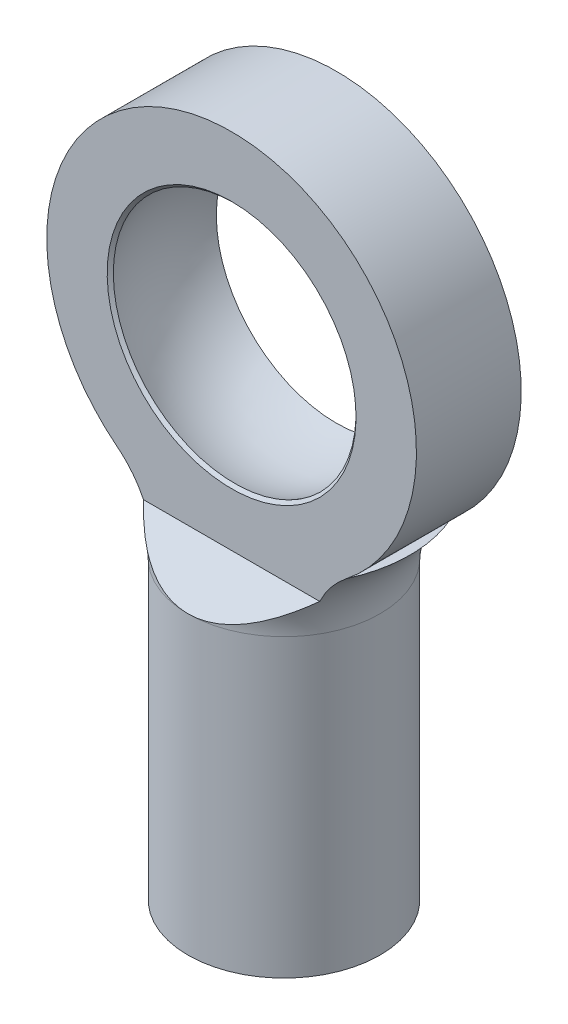
from build123d import *

# Parameters (mm, degrees)
CUT_EXTRUDE1_DEPTH      = 22.459263734
CUT_EXTRUDE1_DEPTH_BACK = 22.459263734
CUT_EXTRUDE2_DEPTH      = 21.923969522
CUT_EXTRUDE2_DEPTH_BACK = 21.923969522
SKETCH3_R               = 3
CHAMFER1_SIZE           = 0.125
CHAMFER1_SIZE2          = 0.094947636
CUT_EXTRUDE3_DEPTH      = 22.17339134
CUT_EXTRUDE3_DEPTH_BACK = 22.17339134
SKETCH7_R               = 1.5
CUT_EXTRUDE4_DEPTH      = 5


with BuildPart() as part:
    # Sketch1 → Revolve1 (revolve)
    with BuildSketch(Plane.XY, mode=Mode.PRIVATE) as revolve1_sk:
        with BuildLine():
            Line((0, 11), (0, 0))
            Line((0, 0), (2.75, 0))
            Line((2.75, 0), (2.75, 8.463651766))
            ThreePointArc((2.75, 8.463651766), (2.97496566, 9.500097013), (3.609375, 10.350010589))
            ThreePointArc((3.609375, 10.350010589), (5.151453278, 16.426792444), (0, 20))
            Line((0, 20), (0, 11))
        make_face()
    revolve(revolve1_sk.sketch.rotate(Axis((0, 0, 0), (0, -1, 0)), 90), axis=Axis((0, 0, 0), (0, -1, 0)))

    # Sketch2 → Cut-Extrude1 (cut, two sides: drawn at the far end of the back side and taken through both)
    with BuildSketch(Plane(origin=(0, 0, 0), x_dir=(0, 0, -1), z_dir=(1, 0, 0)).offset(-CUT_EXTRUDE1_DEPTH_BACK)):
        Polygon((-6.5, 9.406831178), (-2.75, 8.463651766), (-1.5, 9.406831178), (-1.5, 20.406831178), (-6.5, 20.406831178), align=None)
        Polygon((6.5, 20.406831178), (6.5, 9.406831178), (2.75, 8.463651766), (1.5, 9.406831178), (1.5, 20.406831178), align=None)
    extrude(amount=CUT_EXTRUDE1_DEPTH + CUT_EXTRUDE1_DEPTH_BACK, mode=Mode.SUBTRACT)

    # Sketch3 → Cut-Extrude2 (cut, two sides: drawn at the far end of the back side and taken through both)
    with BuildSketch(Plane.XY.offset(-CUT_EXTRUDE2_DEPTH_BACK)):
        with Locations(Location((0, 14.5, 0), (0, 0, 90))):
            Circle(SKETCH3_R)
    extrude(amount=CUT_EXTRUDE2_DEPTH + CUT_EXTRUDE2_DEPTH_BACK, mode=Mode.SUBTRACT)

    # Sketch5 → Cut-Revolve2 (revolve, cut)
    with BuildSketch(Plane.XY):
        with BuildLine():
            Line((0, 18.25), (0, 10.75))
            ThreePointArc((0, 10.75), (3.75, 14.5), (0, 18.25))
        make_face()
    revolve(axis=Axis((0, 18.25, 0), (0, -1, 0)), mode=Mode.SUBTRACT)

    # Chamfer1
    chamfer1_edges = [part.edges().sort_by_distance(p)[0] for p in [
        (0, 17.936931771, 1.5),
    ]]
    chamfer1_side = [part.faces().sort_by_distance(p)[0] for p in [
        (0, 9.555101677, 1.5),
    ]]
    chamfer(chamfer1_edges, length=CHAMFER1_SIZE, length2=CHAMFER1_SIZE2, reference=chamfer1_side[0])

    # Sketch6 → Cut-Extrude3 (cut, two sides: drawn at the far end of the back side and taken through both)
    with BuildSketch(Plane.XY.offset(1.5).offset(-CUT_EXTRUDE3_DEPTH_BACK)):
        with BuildLine():
            Line((-3.609375, 10.350010589), (-3.28292368, 10.350010589))
            ThreePointArc((-3.28292368, 10.350010589), (0, 19.791502622), (3.28292368, 10.350010589))
            Line((3.28292368, 10.350010589), (3.609375, 10.350010589))
            ThreePointArc((3.609375, 10.350010589), (0, 20), (-3.609375, 10.350010589))
        make_face()
    extrude(amount=CUT_EXTRUDE3_DEPTH + CUT_EXTRUDE3_DEPTH_BACK, mode=Mode.SUBTRACT)

    # Sketch7 → Cut-Extrude4 (cut)
    with BuildSketch(Plane.XZ):
        with Locations(Location((0, 0, 0), (0, 0, 270))):
            Circle(SKETCH7_R)
    extrude(amount=-CUT_EXTRUDE4_DEPTH, mode=Mode.SUBTRACT)


solid = part.part
